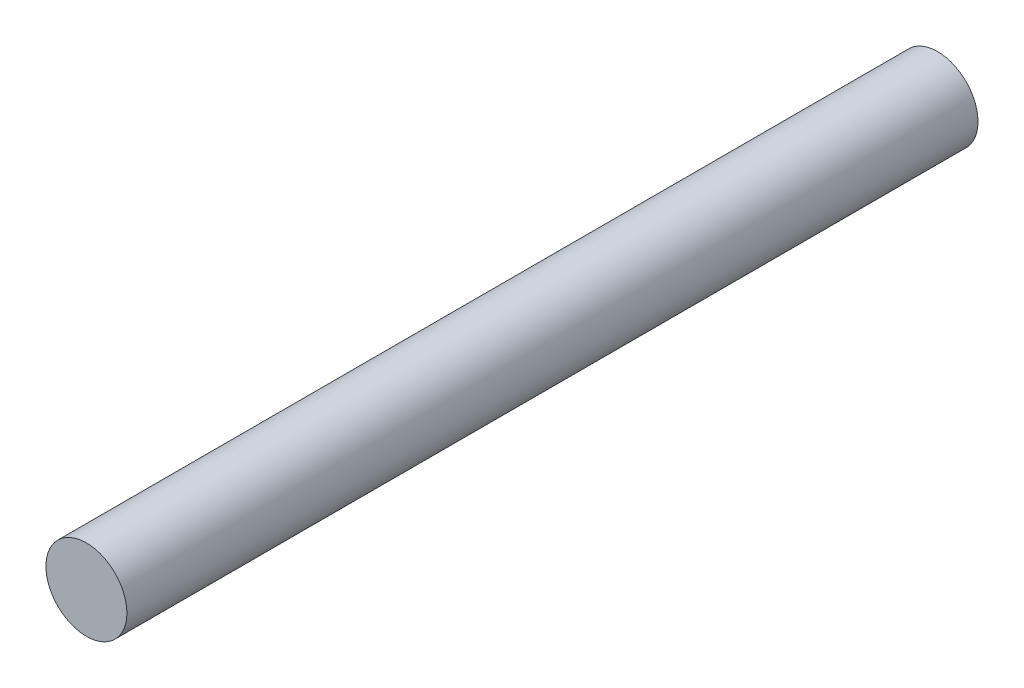
from build123d import *

# Parameters (mm, degrees)
SKETCH1_R           = 1.90291704
BOSS_EXTRUDE1_DEPTH = 20


with BuildPart() as part:
    # Sketch1 → Boss-Extrude1 (new, symmetric)
    with BuildSketch(Plane.XY):
        Circle(SKETCH1_R)
    extrude(amount=BOSS_EXTRUDE1_DEPTH, both=True)


solid = part.part
